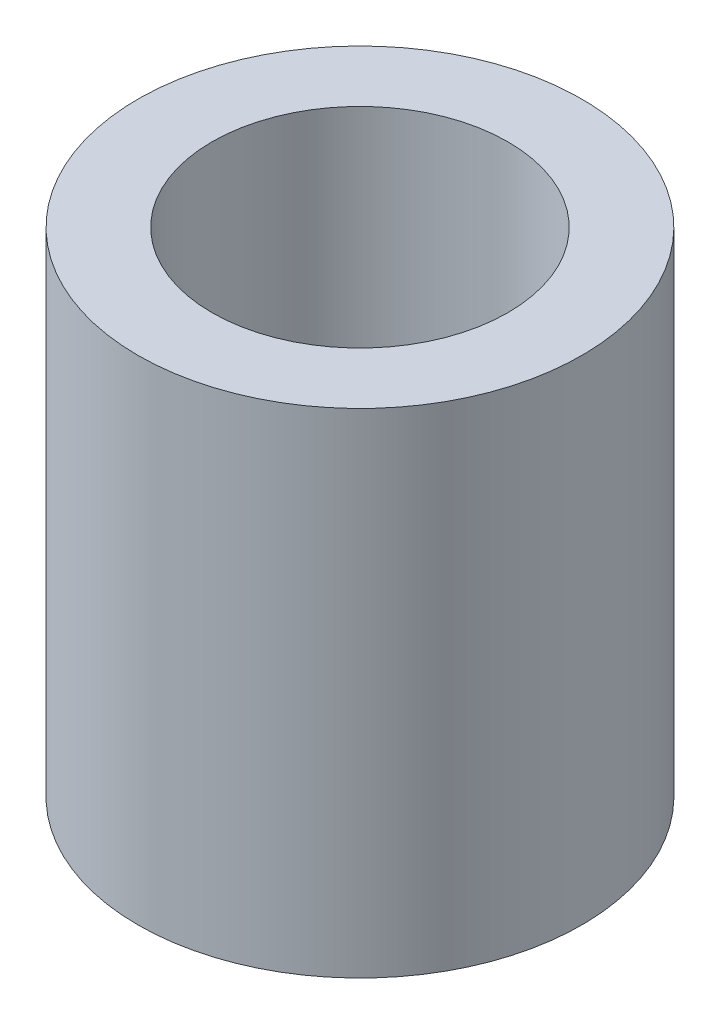
from build123d import *

# Parameters (mm, degrees)
SKETCH1_R           = 2.25
SKETCH1_R_2         = 1.5
BOSS_EXTRUDE1_DEPTH = 5


with BuildPart() as part:
    # Sketch1 → Boss-Extrude1 (new body)
    with BuildSketch(Plane(origin=(0, 0, 0), x_dir=(1, 0, 0), z_dir=(0, 1, 0))):
        with Locations(Location((0, 0, 0), (0, 0, 270))):
            Circle(SKETCH1_R)
        with Locations(Location((0, 0, 0), (0, 0, 270))):
            Circle(SKETCH1_R_2, mode=Mode.SUBTRACT)
    extrude(amount=BOSS_EXTRUDE1_DEPTH)


solid = part.part
